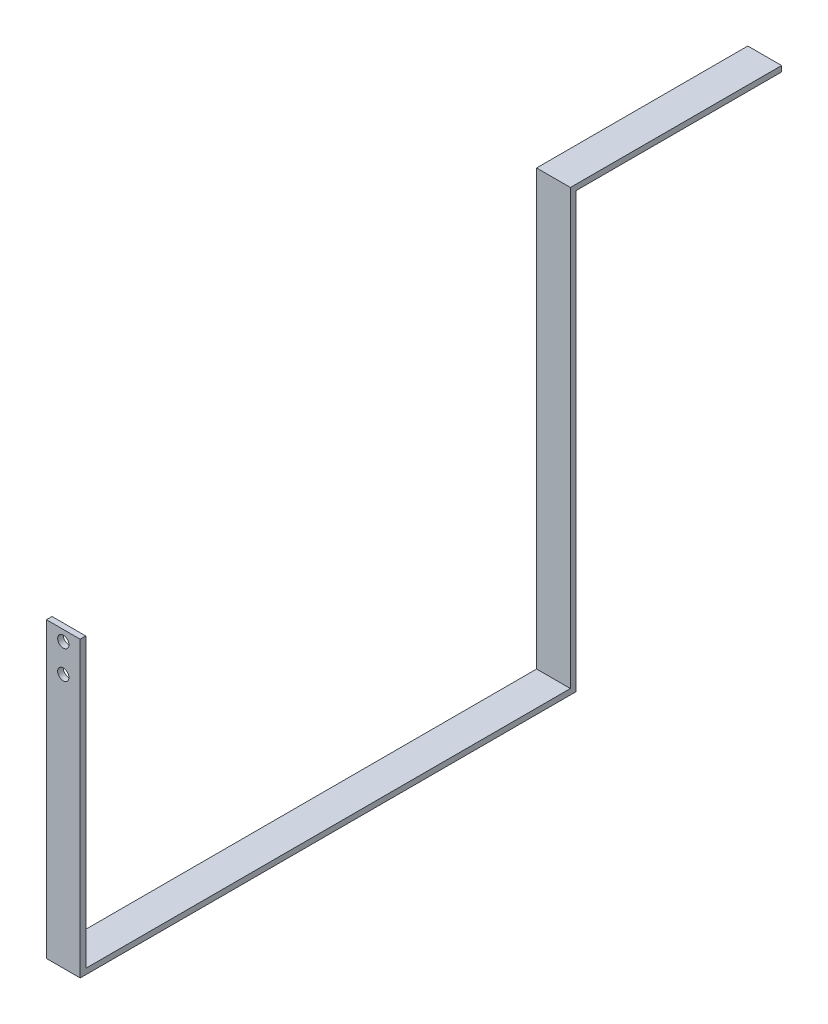
from build123d import *

# Parameters (mm, degrees)
CROQUIS1_W              = 38.1
CROQUIS1_H              = 6.31
SALIENTE_EXTRUIR1_DEPTH = 238.06
CROQUIS2_W              = 38.1
CROQUIS2_H              = 6.31
SALIENTE_EXTRUIR2_DEPTH = 489.1
CROQUIS3_W              = 38.1
CROQUIS3_H              = 6.31
SALIENTE_EXTRUIR3_DEPTH = 552.5
CROQUIS4_W              = 38.1
CROQUIS4_H              = 6.31
SALIENTE_EXTRUIR4_DEPTH = 324.39
CROQUIS5_R              = 6.35
CORTAR_EXTRUIR1_DEPTH   = 6.31


with BuildPart() as part:
    # Croquis1 → Saliente-Extruir1 (new body)
    with BuildSketch(Plane.XY):
        Rectangle(CROQUIS1_W, CROQUIS1_H)
    extrude(amount=SALIENTE_EXTRUIR1_DEPTH)

    # Croquis2 → Saliente-Extruir2 (add)
    with BuildSketch(Plane.XZ.offset(3.155)):
        with Locations((0, 234.905)):
            Rectangle(CROQUIS2_W, CROQUIS2_H)
    extrude(amount=SALIENTE_EXTRUIR2_DEPTH)

    # Croquis3 → Saliente-Extruir3 (add)
    with BuildSketch(Plane.XY.offset(238.06)):
        with Locations((0, -489.1)):
            Rectangle(CROQUIS3_W, CROQUIS3_H)
    extrude(amount=SALIENTE_EXTRUIR3_DEPTH)

    # Croquis4 → Saliente-Extruir4 (add)
    with BuildSketch(Plane(origin=(0, -485.945, 0), x_dir=(1, 0, 0), z_dir=(0, 1, 0))):
        with Locations((0, -787.405)):
            Rectangle(CROQUIS4_W, CROQUIS4_H)
    extrude(amount=SALIENTE_EXTRUIR4_DEPTH)

    # Croquis5 → Cortar-Extruir1 (cut)
    with BuildSketch(Plane.XY.offset(790.56)):
        with Locations((0, -173.447204666)):
            Circle(CROQUIS5_R)
        with Locations((0, -205.447204666)):
            Circle(CROQUIS5_R)
    extrude(amount=-CORTAR_EXTRUIR1_DEPTH, mode=Mode.SUBTRACT)


solid = part.part
